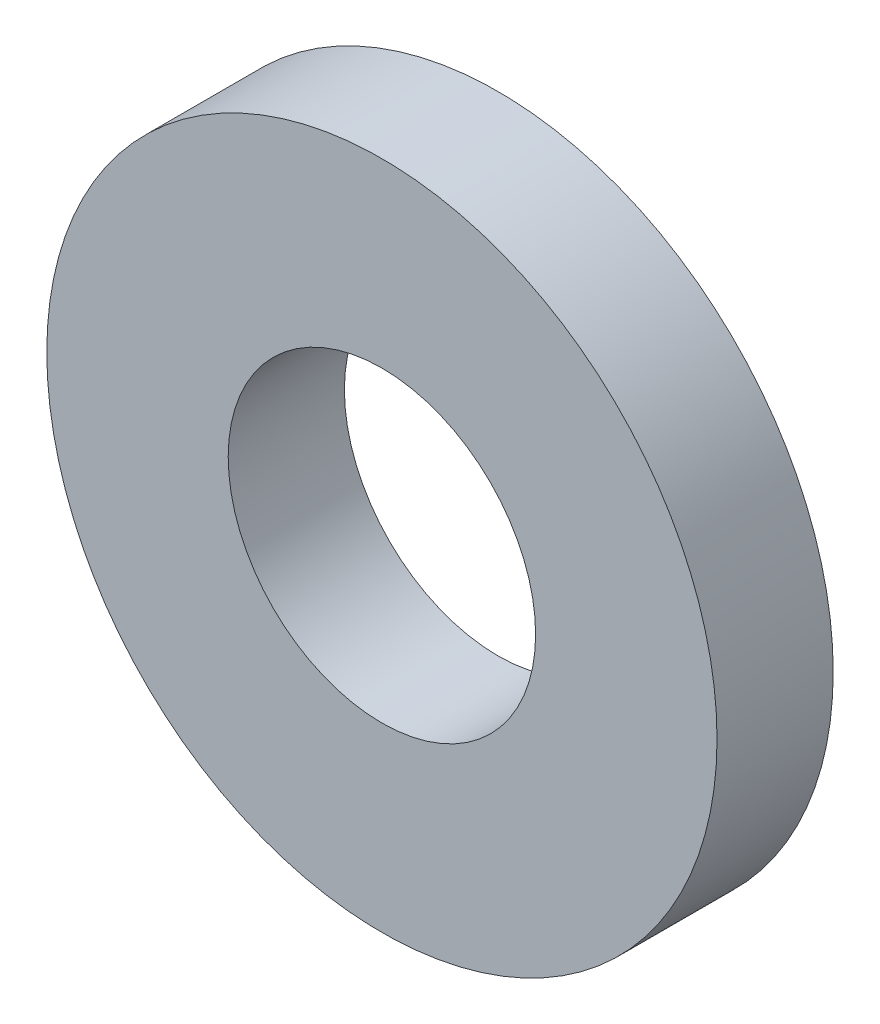
from build123d import *

# Parameters (mm, degrees)
SKETCH1_R      = 4.7625
SKETCH1_R_2    = 2.1844
EXTRUDE1_DEPTH = 1.651


with BuildPart() as part:
    # Sketch1 → Extrude1 (new body)
    with BuildSketch(Plane.XY):
        with Locations(Location((0, 0, 0), (0, 0, 180))):
            Circle(SKETCH1_R)
        with Locations(Location((0, 0, 0), (0, 0, 180))):
            Circle(SKETCH1_R_2, mode=Mode.SUBTRACT)
    extrude(amount=EXTRUDE1_DEPTH)


solid = part.part
